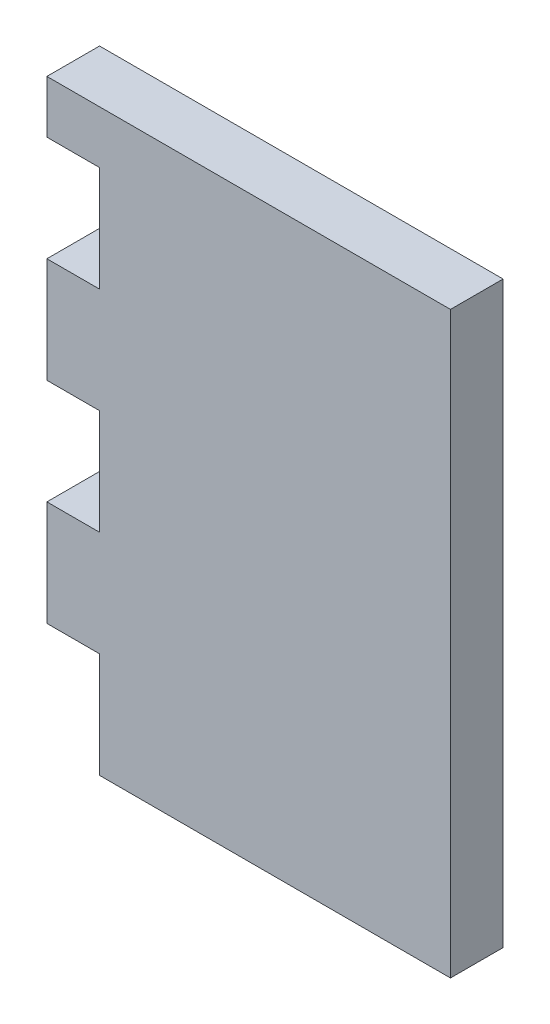
from build123d import *

# Parameters (mm, degrees)
BOSS_EXTRUDE1_DEPTH = 6


with BuildPart() as part:
    # Sketch1 → Boss-Extrude1 (new body)
    with BuildSketch(Plane.XY):
        Polygon((6, -42), (0, -42), (0, -54), (6, -54), (6, -66), (46, -66), (46, 0), (0, 0), (0, -6), (6, -6), (6, -18), (0, -18), (0, -30), (6, -30), align=None)
    extrude(amount=BOSS_EXTRUDE1_DEPTH)


solid = part.part
